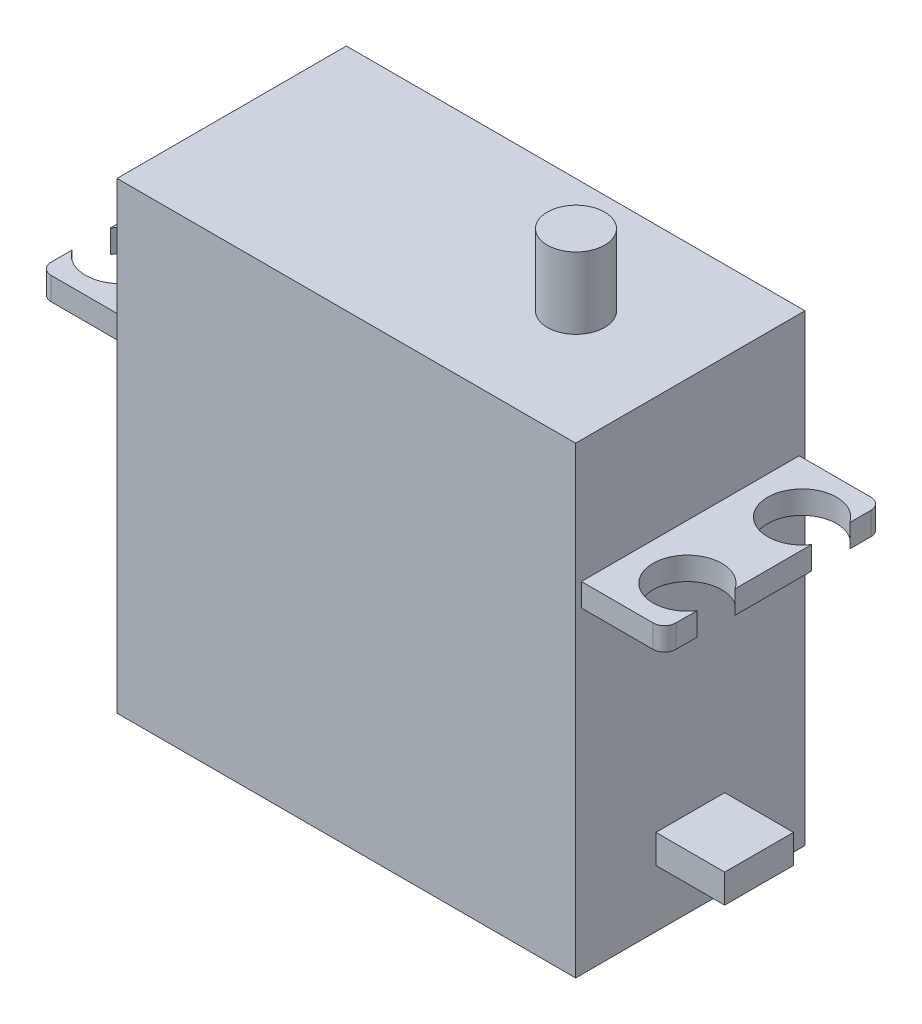
from build123d import *

# Parameters (mm, degrees)
SKETCH1_W           = 40
SKETCH1_H           = 40.4
BOSS_EXTRUDE1_DEPTH = 20
SKETCH2_W           = 54.5
SKETCH2_H           = 19
BOSS_EXTRUDE2_DEPTH = 2
SKETCH3_R           = 3
CUT_EXTRUDE1_DEPTH  = 60.284504721
FILLET1_R           = 1
SKETCH4_R           = 2.5
BOSS_EXTRUDE3_DEPTH = 6.223
SKETCH5_W           = 6
SKETCH5_H           = 2.5
BOSS_EXTRUDE4_DEPTH = 6


with BuildPart() as part:
    # Sketch1 → Boss-Extrude1 (new body)
    with BuildSketch(Plane.XY):
        with Locations((20, 20.2)):
            Rectangle(SKETCH1_W, SKETCH1_H)
    extrude(amount=BOSS_EXTRUDE1_DEPTH)

    # Sketch2 → Boss-Extrude2 (add)
    with BuildSketch(Plane(origin=(0, 27.7, 0), x_dir=(-1, 0, 0), z_dir=(0, -1, 0))):
        with Locations((-20, -10)):
            Rectangle(SKETCH2_W, SKETCH2_H)
    extrude(amount=-BOSS_EXTRUDE2_DEPTH)

    # Sketch3 → Cut-Extrude1 (cut, through all)
    with BuildSketch(Plane(origin=(0, 29.7, 0), x_dir=(1, 0, 0), z_dir=(0, 1, 0))):
        with Locations((-4.75, -15)):
            Circle(SKETCH3_R)
        with Locations((-4.75, -5)):
            Circle(SKETCH3_R)
        with Locations((44.75, -5)):
            Circle(SKETCH3_R)
        with Locations((44.75, -15)):
            Circle(SKETCH3_R)
    extrude(amount=-CUT_EXTRUDE1_DEPTH, mode=Mode.SUBTRACT)

    # Fillet1
    fillet1_edges = [part.edges().sort_by_distance(p)[0] for p in [
        (-7.25, 28.7, 19.5),
        (47.25, 28.7, 0.5),
        (-7.25, 28.7, 0.5),
        (47.25, 28.7, 19.5),
    ]]
    fillet(fillet1_edges, radius=FILLET1_R)

    # Sketch4 → Boss-Extrude3 (add)
    with BuildSketch(Plane(origin=(0, 40.4, 0), x_dir=(1, 0, 0), z_dir=(0, 1, 0))):
        with Locations(Location((30.03, -10, 0), (0, 0, 90))):
            Circle(SKETCH4_R)
    extrude(amount=BOSS_EXTRUDE3_DEPTH)

    # Sketch5 → Boss-Extrude4 (add)
    with BuildSketch(Plane(origin=(40, 0, 0), x_dir=(0, 0, -1), z_dir=(1, 0, 0))):
        with Locations((-10, 6.25)):
            Rectangle(SKETCH5_W, SKETCH5_H)
    extrude(amount=BOSS_EXTRUDE4_DEPTH)


solid = part.part
